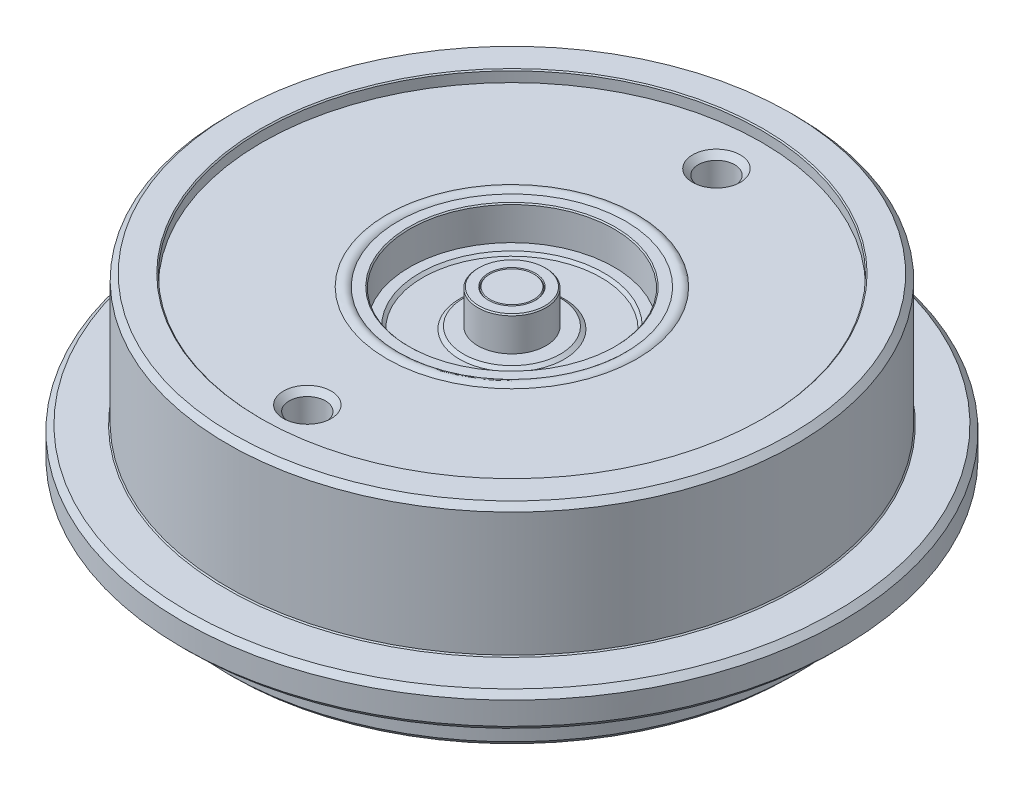
from build123d import *

# Parameters (mm, degrees)
SKETCH2_R          = 1.6
CUT_EXTRUDE1_DEPTH = 6
SKETCH4_R          = 1.6
CUT_EXTRUDE2_DEPTH = 6
CHAMFER3_SIZE      = 0.1
CHAMFER1_SIZE      = 0.5


with BuildPart() as part:
    # Sketch1 → Revolve4 (revolve)
    with BuildSketch(Plane.XY, mode=Mode.PRIVATE) as revolve4_sk:
        with BuildLine():
            Line((840.942387276, 295.38888375), (840.051505549, 295.38888375))
            Line((840.051505549, 295.38888375), (839.795142101, 295.163855609))
            Line((839.795142101, 295.163855609), (836.54874871, 295.163855609))
            Line((836.54874871, 295.163855609), (836.207694111, 295.38888375))
            Line((836.207694111, 295.38888375), (834.942387276, 295.38888375))
            Line((834.942387276, 295.38888375), (834.942387276, 298.38888375))
            Line((834.942387276, 298.38888375), (834.009912561, 298.38888375))
            Line((834.009912561, 298.38888375), (833.942387276, 298.320272963))
            Line((833.942387276, 298.320272963), (833.872673537, 298.38888375))
            Line((833.872673537, 298.38888375), (831.942387276, 298.38888375))
            Line((831.942387276, 298.38888375), (831.942387276, 270.88888375))
            Line((831.942387276, 270.88888375), (834.942387276, 270.88888375))
            Line((834.942387276, 270.88888375), (834.942387276, 281.38888375))
            Line((834.942387276, 281.38888375), (836.2976122, 281.38888375))
            Line((836.2976122, 281.38888375), (836.54874871, 281.619976989))
            Line((836.54874871, 281.619976989), (839.795142101, 281.619976989))
            Line((839.795142101, 281.619976989), (840.007791728, 281.38888375))
            Line((840.007791728, 281.38888375), (841.442387276, 281.38888375))
            Line((841.442387276, 281.38888375), (841.942387276, 280.88888375))
            Line((841.942387276, 280.88888375), (856.942387276, 280.88888375))
            Line((856.942387276, 280.88888375), (856.942387276, 284.88888375))
            Line((856.942387276, 284.88888375), (860.942387276, 284.88888375))
            Line((860.942387276, 284.88888375), (860.942387276, 287.88888375))
            Line((860.942387276, 287.88888375), (856.942387276, 287.88888375))
            Line((856.942387276, 287.88888375), (856.942387276, 299.38888375))
            Line((856.942387276, 299.38888375), (853.942387276, 299.38888375))
            Line((853.942387276, 299.38888375), (853.942387276, 298.38888375))
            Line((853.942387276, 298.38888375), (842.942387276, 298.38888375))
            ThreePointArc((842.942387276, 298.38888375), (842.442387276, 298.595990531), (841.942387276, 298.38888375))
            Line((841.942387276, 298.38888375), (840.942387276, 298.38888375))
            Line((840.942387276, 298.38888375), (840.942387276, 295.38888375))
        make_face()
    revolve(revolve4_sk.sketch.rotate(Axis((831.942387276, 300.670444461, 0), (0, -1, 0)), 90), axis=Axis((831.942387276, 300.670444461, 0), (0, -1, 0)))

    # Sketch2 → Cut-Extrude1 (cut)
    with BuildSketch(Plane(origin=(0, 298.38888375, 0), x_dir=(-1, 0, 0), z_dir=(0, 1, 0))):
        with Locations(Location((-831.939085095, 17.999999697, 0), (0, 0, 90))):
            Circle(SKETCH2_R)
        with Locations(Location((-831.939085095, -17.999999697, 0), (0, 0, 90))):
            Circle(SKETCH2_R)
    extrude(amount=-CUT_EXTRUDE1_DEPTH, mode=Mode.SUBTRACT)

    # Sketch4 → Cut-Extrude2 (cut)
    with BuildSketch(Plane.XZ.offset(-280.88888375)):
        with Locations(Location((852.942387276, 0, 0), (0, 0, 270))):
            Circle(SKETCH4_R)
        with Locations(Location((821.442387276, -18.186533479, 0), (0, 0, 270))):
            Circle(SKETCH4_R)
        with Locations(Location((821.442387276, 18.186533479, 0), (0, 0, 270))):
            Circle(SKETCH4_R)
    extrude(amount=-CUT_EXTRUDE2_DEPTH, mode=Mode.SUBTRACT)

    # Cut-Extrude3 cone 1 section (through the dimple's axis) → Cut-Extrude3 (revolve, cut)
    with BuildSketch(Plane(origin=(831.939085095, 292.38888375, 17.999999697), x_dir=(0, 0, 1), z_dir=(1, 0, 0))):
        Polygon((0, 0), (1.6, 0), (0, 1.120332061), align=None)
    revolve(axis=Axis((831.939085095, 292.38888375, 17.999999697), (0, -1, 0)), mode=Mode.SUBTRACT)

    # Cut-Extrude3 cone 2 section (through the dimple's axis) → Cut-Extrude3 cone 2 (revolve, cut)
    with BuildSketch(Plane(origin=(831.939085095, 292.38888375, -17.999999697), x_dir=(0, 0, 1), z_dir=(1, 0, 0))):
        Polygon((0, 0), (1.6, 0), (0, 1.120332061), align=None)
    revolve(axis=Axis((831.939085095, 292.38888375, -17.999999697), (0, -1, 0)), mode=Mode.SUBTRACT)

    # Cut-Extrude4 cone 1 section (through the dimple's axis) → Cut-Extrude4 (revolve, cut)
    with BuildSketch(Plane(origin=(821.442387276, 286.88888375, 18.186533479), x_dir=(0, 0, -1), z_dir=(1, 0, 0))):
        Polygon((0, 0), (1.6, 0), (0, 1.120332061), align=None)
    revolve(axis=Axis((821.442387276, 286.88888375, 18.186533479), (0, 1, 0)), mode=Mode.SUBTRACT)

    # Cut-Extrude4 cone 2 section (through the dimple's axis) → Cut-Extrude4 cone 2 (revolve, cut)
    with BuildSketch(Plane(origin=(821.442387276, 286.88888375, -18.186533479), x_dir=(0, 0, -1), z_dir=(1, 0, 0))):
        Polygon((0, 0), (1.6, 0), (0, 1.120332061), align=None)
    revolve(axis=Axis((821.442387276, 286.88888375, -18.186533479), (0, 1, 0)), mode=Mode.SUBTRACT)

    # Cut-Extrude4 cone 3 section (through the dimple's axis) → Cut-Extrude4 cone 3 (revolve, cut)
    with BuildSketch(Plane(origin=(852.942387276, 286.88888375, 0), x_dir=(0, 0, -1), z_dir=(1, 0, 0))):
        Polygon((0, 0), (1.6, 0), (0, 1.120332061), align=None)
    revolve(axis=Axis((852.942387276, 286.88888375, 0), (0, 1, 0)), mode=Mode.SUBTRACT)

    # Chamfer3
    chamfer3_edges = [part.edges().sort_by_distance(p)[0] for p in [
        (831.942387276, 298.38888375, -3),
        (831.942387276, 284.88888375, -25),
        (831.942387276, 287.88888375, -25),
        (831.942387276, 299.38888375, -22),
        (831.942387276, 298.38888375, -9),
    ]]
    chamfer(chamfer3_edges, length=CHAMFER3_SIZE)

    # Chamfer1
    chamfer1_edges = [part.edges().sort_by_distance(p)[0] for p in [
        (831.942387276, 270.88888375, -3),
        (831.942387276, 280.88888375, -25),
        (831.942387276, 284.88888375, -29),
        (831.942387276, 287.88888375, -29),
        (831.942387276, 299.38888375, -25),
        (831.939085095, 298.38888375, 16.399999697),
        (831.939085095, 298.38888375, -19.599999697),
        (852.942387276, 280.88888375, 1.6),
        (821.442387276, 280.88888375, -16.586533479),
        (821.442387276, 280.88888375, 19.786533479),
    ]]
    chamfer(chamfer1_edges, length=CHAMFER1_SIZE)


solid = part.part
